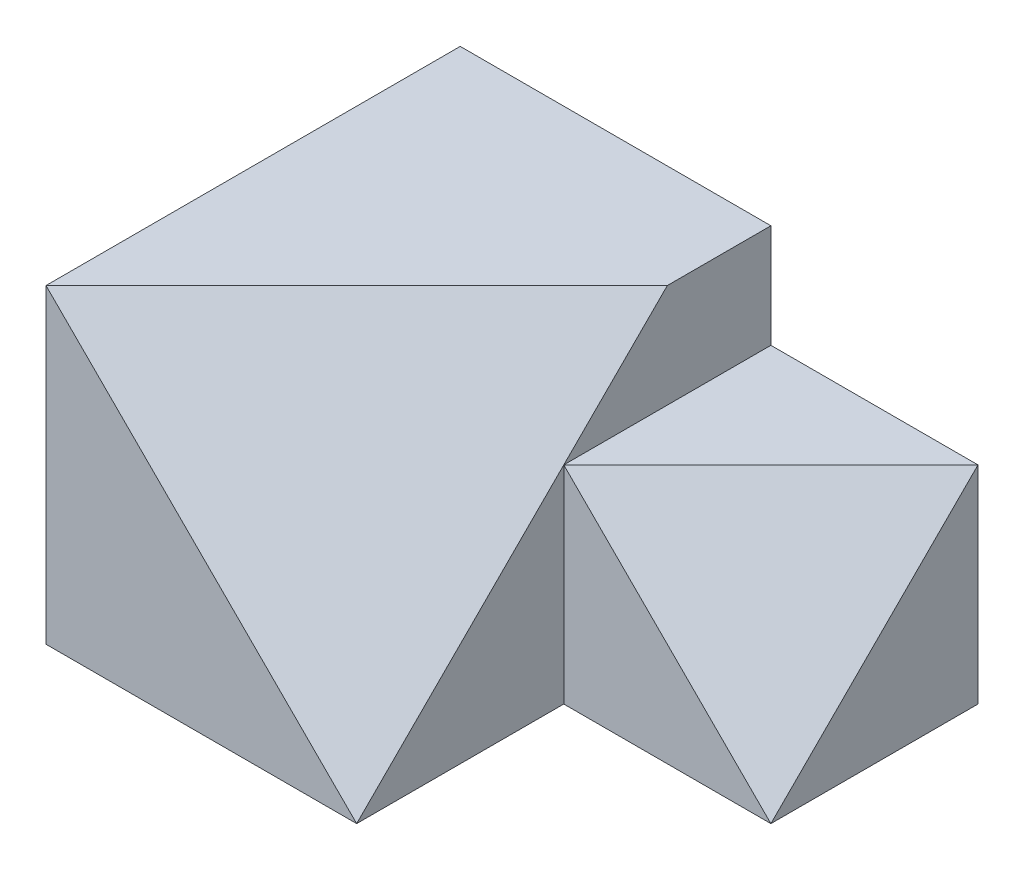
from build123d import *

# Parameters (mm, degrees)
SKETCH1_W           = 762
SKETCH1_H           = 762
BOSS_EXTRUDE2_DEPTH = 1016
SKETCH1_4_W         = 508
SKETCH1_4_H         = 508
BOSS_EXTRUDE3_DEPTH = 508


with BuildPart() as part:
    # Sketch1 → Boss-Extrude2 (new body)
    with BuildSketch(Plane.XY):
        with Locations((-381, 381)):
            Rectangle(SKETCH1_W, SKETCH1_H)
    extrude(amount=BOSS_EXTRUDE2_DEPTH)

    # Sketch1<4> → Boss-Extrude3 (add)
    with BuildSketch(Plane.XY):
        with Locations((254, 254)):
            Rectangle(SKETCH1_4_W, SKETCH1_4_H)
    extrude(amount=BOSS_EXTRUDE3_DEPTH)

    # SurfaceCut1
    split(bisect_by=Plane(origin=(338.666666667, 338.666666667, 338.666666667), x_dir=(0.816496580927726, -0.408248290463863, -0.408248290463863), z_dir=(0.5773502691896258, 0.5773502691896262, 0.5773502691896255)), keep=Keep.BOTTOM)


solid = part.part
